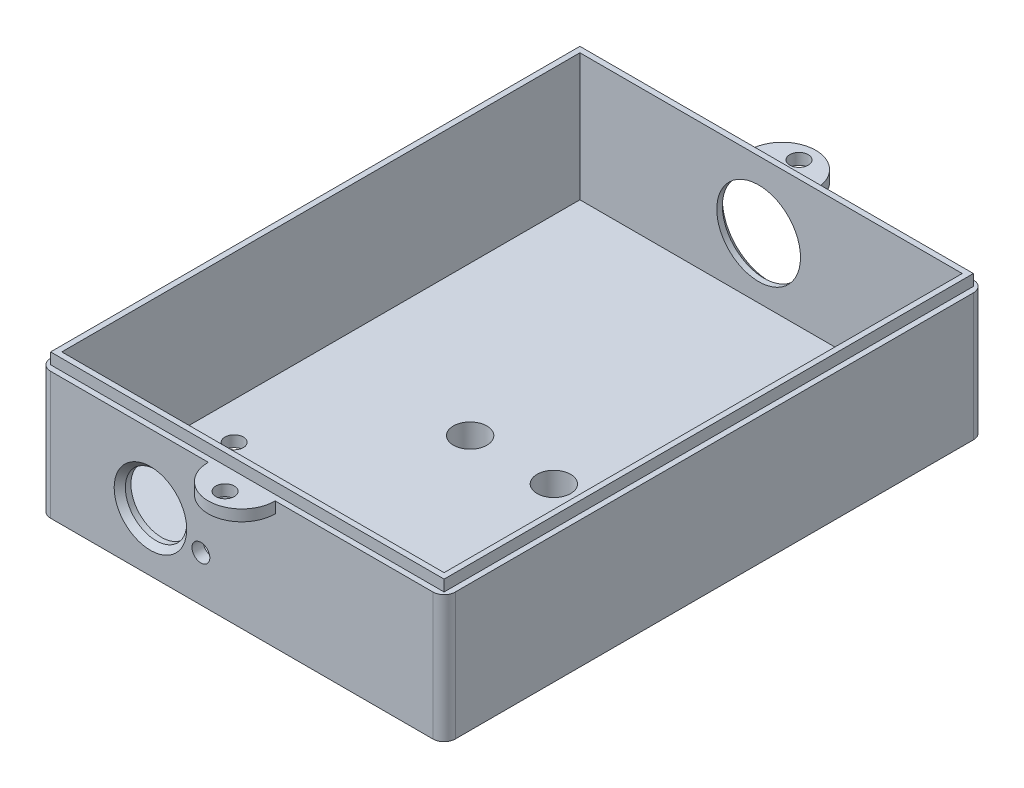
from build123d import *

# Parameters (mm, degrees)
BOSS_EXTRUDE1_DEPTH      = 18
BOSS_EXTRUDE1_DEPTH_BACK = 12.815459
SKETCH1_W                = 72.5
SKETCH1_H                = 96.828401578
SHELL1_T                 = 2
SKETCH2_R                = 7.5
CUT_EXTRUDE1_DEPTH       = 2
CHAMFER1_SIZE            = 1
SKETCH5_R                = 5.5
CUT_EXTRUDE2_DEPTH       = 2
CHAMFER2_SIZE            = 1
SKETCH8_W                = 72.5
SKETCH8_H                = 96.828401578
CUT_EXTRUDE5_DEPTH       = 8
BOSS_EXTRUDE3_START      = 10
SKETCH10_W               = 70.5
SKETCH10_H               = 94.828401578
SKETCH10_W_2             = 68.5
SKETCH10_H_2             = 92.828401578
BOSS_EXTRUDE3_DEPTH      = 2
CUT_EXTRUDE6_REACH       = 183.831
SKETCH12_R               = 1.6
FILLET1_R                = 2
BOSS_EXTRUDE4_START      = 10
SKETCH13_R               = 1.65
BOSS_EXTRUDE4_DEPTH      = 2
SKETCH16_R               = 1.65
BOSS_EXTRUDE5_DEPTH      = 2
SKETCH17_R               = 1.65
CUT_EXTRUDE8_DEPTH       = 12.81545914
SKETCH19_W               = 44.967113154
SKETCH19_H               = 24.357186292
BOSS_EXTRUDE6_DEPTH      = 12
CUT_EXTRUDE9_START       = -10.815459
SKETCH18_R               = 3
CUT_EXTRUDE9_DEPTH       = 14
SKETCH14_R               = 1.599946
CUT_EXTRUDE7_DEPTH       = 2


with BuildPart() as part:
    # Sketch1 → Boss-Extrude1 (new, two sides: drawn at the far end of the back side and taken through both)
    with BuildSketch(Plane(origin=(0, 0, 0), x_dir=(1, 0, 0), z_dir=(0, 1, 0)).offset(-BOSS_EXTRUDE1_DEPTH_BACK)):
        with Locations((117.12025684, -15.018542133)):
            Rectangle(SKETCH1_W, SKETCH1_H)
    extrude(amount=BOSS_EXTRUDE1_DEPTH + BOSS_EXTRUDE1_DEPTH_BACK)

    # Shell1 (no face opened: a closed hollow body)
    add(offset(amount=-SHELL1_T, mode=Mode.PRIVATE), mode=Mode.SUBTRACT)

    # Sketch2 → Cut-Extrude1 (cut)
    with BuildSketch(Plane(origin=(0, 0, -33.395658656), x_dir=(-1, 0, 0), z_dir=(0, 0, -1))):
        with Locations((-114.89374317, -0.00045914)):
            Circle(SKETCH2_R)
    extrude(amount=-CUT_EXTRUDE1_DEPTH, mode=Mode.SUBTRACT)

    # Chamfer1
    chamfer1_edges = [part.edges().sort_by_distance(p)[0] for p in [
        (122.39374317, -0.00045914, -33.395658656),
    ]]
    chamfer(chamfer1_edges, length=CHAMFER1_SIZE)

    # Sketch5 → Cut-Extrude2 (cut)
    with BuildSketch(Plane.XY.offset(63.432742922)):
        with Locations((100.762134065, -2.34045914)):
            Circle(SKETCH5_R)
    extrude(amount=-CUT_EXTRUDE2_DEPTH, mode=Mode.SUBTRACT)

    # Chamfer2
    chamfer2_edges = [part.edges().sort_by_distance(p)[0] for p in [
        (95.262134065, -2.34045914, 63.432742922),
    ]]
    chamfer(chamfer2_edges, length=CHAMFER2_SIZE)

    # Sketch8 → Cut-Extrude5 (cut)
    with BuildSketch(Plane(origin=(0, 18, 0), x_dir=(1, 0, 0), z_dir=(0, 1, 0))):
        with Locations((117.12025684, -15.018542133)):
            Rectangle(SKETCH8_W, SKETCH8_H)
    extrude(amount=-CUT_EXTRUDE5_DEPTH, mode=Mode.SUBTRACT)

    # Sketch10 → Boss-Extrude3 (add)
    with BuildSketch(Plane(origin=(0, 0, 0), x_dir=(1, 0, 0), z_dir=(0, 1, 0)).offset(BOSS_EXTRUDE3_START)):
        with Locations((117.12025684, -15.018542133)):
            Rectangle(SKETCH10_W, SKETCH10_H)
        with Locations((117.12025684, -15.018542133)):
            Rectangle(SKETCH10_W_2, SKETCH10_H_2, mode=Mode.SUBTRACT)
    extrude(amount=BOSS_EXTRUDE3_DEPTH)

    # Sketch12 → Cut-Extrude6 (cut, up to next)
    with BuildSketch(Plane.XY.offset(63.432742922), mode=Mode.PRIVATE) as cut_extrude6_sk1:
        with Locations((109.796270245, -4.680244976)):
            Circle(SKETCH12_R)
    cut_extrude6_tool1 = extrude(cut_extrude6_sk1.sketch, amount=-CUT_EXTRUDE6_REACH, mode=Mode.PRIVATE) & part.part
    add(cut_extrude6_tool1.solids().sort_by_distance((109.79627, -4.680245, 63.432743))[0], mode=Mode.SUBTRACT)

    # Fillet1
    fillet1_edges = [part.edges().sort_by_distance(p)[0] for p in [
        (80.87025684, -1.4077295, -33.395658656),
        (153.37025684, -1.4077295, -33.395658656),
        (153.37025684, -1.4077295, 63.432742922),
        (80.87025684, -1.4077295, 63.432742922),
    ]]
    fillet(fillet1_edges, radius=FILLET1_R)

    # Sketch13 → Boss-Extrude4 (add)
    with BuildSketch(Plane(origin=(0, 0, 0), x_dir=(1, 0, 0), z_dir=(0, 1, 0)).offset(BOSS_EXTRUDE4_START)):
        with BuildLine():
            Line((111.12025684, -63.432742922), (123.12025684, -63.432742922))
            ThreePointArc((123.12025684, -63.432742922), (117.12025684, -69.432742922), (111.12025684, -63.432742922))
        make_face()
        with Locations(Location((117.12025684, -66.432742922, 0), (0, 0, 270))):
            Circle(SKETCH13_R, mode=Mode.SUBTRACT)
    boss_extrude4 = extrude(amount=-BOSS_EXTRUDE4_DEPTH)

    # Sketch16 → Boss-Extrude5 (add)
    with BuildSketch(Plane(origin=(0, 10, 0), x_dir=(1, 0, 0), z_dir=(0, 1, 0))):
        with BuildLine():
            Line((111.12025684, 33.395658656), (123.12025684, 33.395658656))
            ThreePointArc((123.12025684, 33.395658656), (117.12025684, 39.395658656), (111.12025684, 33.395658656))
        make_face()
        with Locations(Location((117.12025684, 36.395658656, 0), (0, 0, 270))):
            Circle(SKETCH16_R, mode=Mode.SUBTRACT)
    extrude(amount=-BOSS_EXTRUDE5_DEPTH)

    # Sketch17 → Cut-Extrude8 (cut)
    with BuildSketch(Plane(origin=(0, 0, 0), x_dir=(1, 0, 0), z_dir=(0, 1, 0))):
        with Locations(Location((137.785174065, -38.462742922, 0), (0, 0, 90))):
            Circle(SKETCH17_R)
        with Locations(Location((89.525174065, -37.192742922, 0), (0, 0, 90))):
            Circle(SKETCH17_R)
    extrude(amount=-CUT_EXTRUDE8_DEPTH, mode=Mode.SUBTRACT)

    # Sketch19 → Boss-Extrude6 (add)
    with BuildSketch(Plane.XZ.offset(12.81545914)):
        with Locations((117.12025684, 15.018542133)):
            Rectangle(SKETCH19_W, SKETCH19_H)
    extrude(amount=BOSS_EXTRUDE6_DEPTH)

    # Sketch18 → Cut-Extrude9 (cut)
    with BuildSketch(Plane(origin=(0, 0, 0), x_dir=(1, 0, 0), z_dir=(0, 1, 0)).offset(CUT_EXTRUDE9_START)):
        with Locations(Location((124.62025684, -15.018542133, 0), (0, 0, 270))):
            Circle(SKETCH18_R)
        with Locations(Location((109.62025684, -15.018542133, 0), (0, 0, 270))):
            Circle(SKETCH18_R)
    extrude(amount=-CUT_EXTRUDE9_DEPTH, mode=Mode.SUBTRACT)

    # Mirror1: Boss-Extrude4 across plane
    add(boss_extrude4.mirror(Plane.XY.offset(15.018542133)))

    # Sketch14 → Cut-Extrude7 (cut)
    with BuildSketch(Plane(origin=(0, -10.81545914, 0), x_dir=(1, 0, 0), z_dir=(0, 1, 0))):
        with Locations(Location((140.517827737, -46.462742922, 0), (0, 0, 270))):
            Circle(SKETCH14_R)
        with Locations(Location((92.257827737, -45.192742922, 0), (0, 0, 270))):
            Circle(SKETCH14_R)
    extrude(amount=-CUT_EXTRUDE7_DEPTH, mode=Mode.SUBTRACT)


solid = part.part
